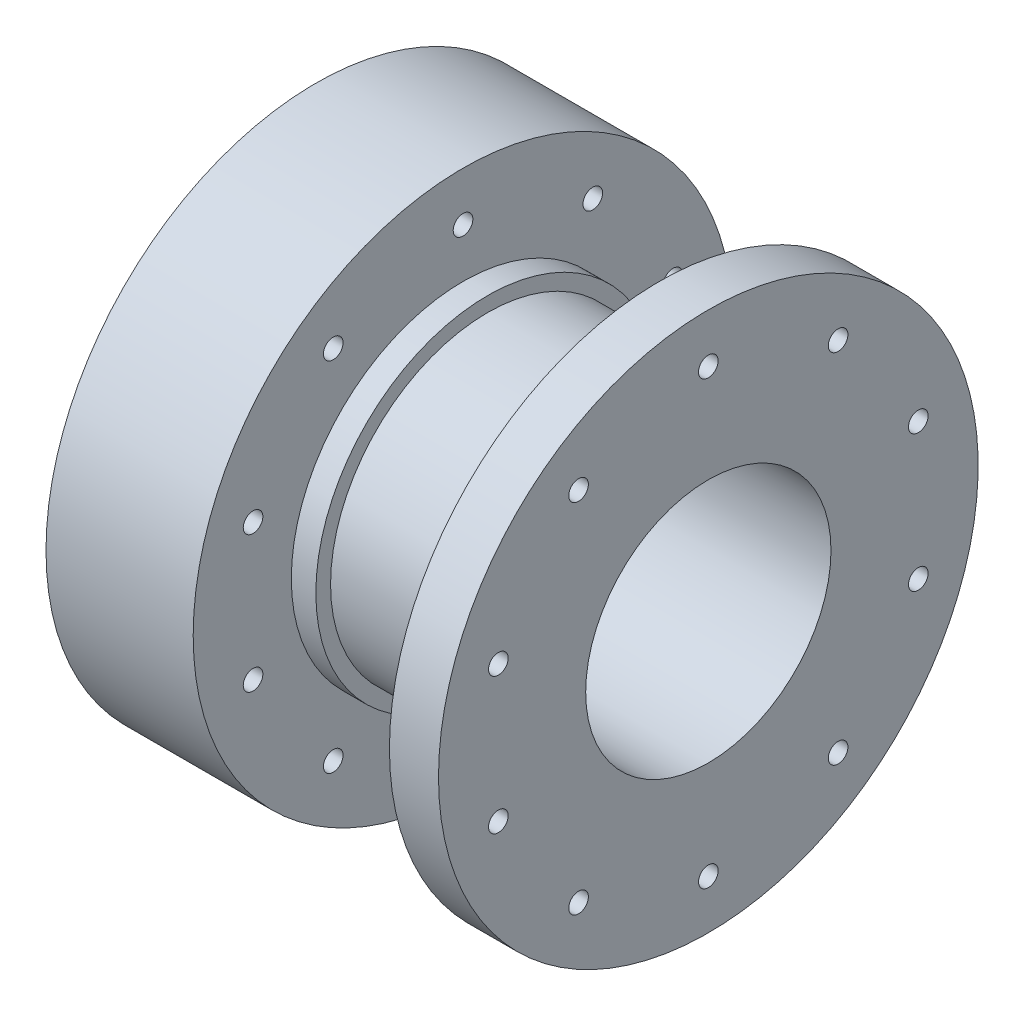
from build123d import *

# Parameters (mm, degrees)
SKETCH2_R          = 2
CUT_EXTRUDE1_DEPTH = 112.579568022


with BuildPart() as part:
    # Sketch1 → Revolve1 (revolve)
    with BuildSketch(Plane.XY, mode=Mode.PRIVATE) as revolve1_sk:
        Polygon((-30, 25), (-30, 35), (-50, 35), (-50, 40), (-30, 40), (-30, 50), (-50, 50), (-50, 55), (-20, 55), (-20, 35), (-15, 35), (-15, 32), (15, 32), (15, 35), (20, 35), (20, 55), (30, 55), (30, 25), (0, 25), align=None)
    revolve(revolve1_sk.sketch.rotate(Axis((-97.55225871, 0, 0), (1, 0, 0)), 90), axis=Axis((-97.55225871, 0, 0), (1, 0, 0)))

    # Sketch2 → Cut-Extrude1 (cut, through all)
    with BuildSketch(Plane(origin=(30, 0, 0), x_dir=(0, 0, -1), z_dir=(1, 0, 0))):
        with Locations((26.450336353, 36.405764747)):
            Circle(SKETCH2_R)
        with Locations((42.797543233, 13.905764747)):
            Circle(SKETCH2_R)
        with Locations((0, 45)):
            Circle(SKETCH2_R)
        with Locations((42.797543233, -13.905764747)):
            Circle(SKETCH2_R)
        with Locations((26.450336353, -36.405764747)):
            Circle(SKETCH2_R)
        with Locations((0, -45)):
            Circle(SKETCH2_R)
        with Locations((-26.450336353, -36.405764747)):
            Circle(SKETCH2_R)
        with Locations((-42.797543233, -13.905764747)):
            Circle(SKETCH2_R)
        with Locations((-42.797543233, 13.905764747)):
            Circle(SKETCH2_R)
        with Locations((-26.450336353, 36.405764747)):
            Circle(SKETCH2_R)
    extrude(amount=-CUT_EXTRUDE1_DEPTH, mode=Mode.SUBTRACT)


solid = part.part
